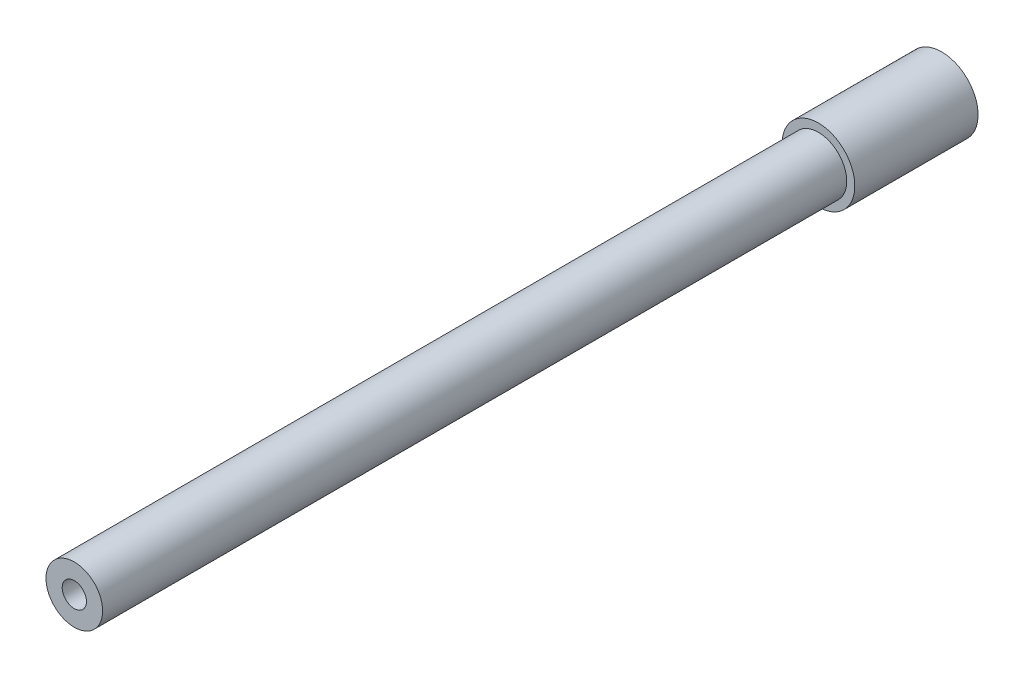
from build123d import *

# Parameters (mm, degrees)
SKETCH1_R           = 1.75
BOSS_EXTRUDE1_DEPTH = 53.62
SKETCH3_R           = 0.75
CUT_EXTRUDE1_DEPTH  = 10
SKETCH4_R           = 2.25
BOSS_EXTRUDE2_DEPTH = 7.62


with BuildPart() as part:
    # Sketch1 → Boss-Extrude1 (new body)
    with BuildSketch(Plane.XY):
        with Locations((5.826393973, 0)):
            Circle(SKETCH1_R)
    extrude(amount=BOSS_EXTRUDE1_DEPTH)

    # Sketch3 → Cut-Extrude1 (cut)
    with BuildSketch(Plane.XY.offset(53.62)):
        with Locations((5.826393973, 0)):
            Circle(SKETCH3_R)
    extrude(amount=-CUT_EXTRUDE1_DEPTH, mode=Mode.SUBTRACT)

    # Sketch4 → Boss-Extrude2 (add)
    with BuildSketch(Plane(origin=(0, 0, 0), x_dir=(-1, 0, 0), z_dir=(0, 0, -1))):
        with Locations((-5.826393973, 0)):
            Circle(SKETCH4_R)
    extrude(amount=-BOSS_EXTRUDE2_DEPTH)


solid = part.part
